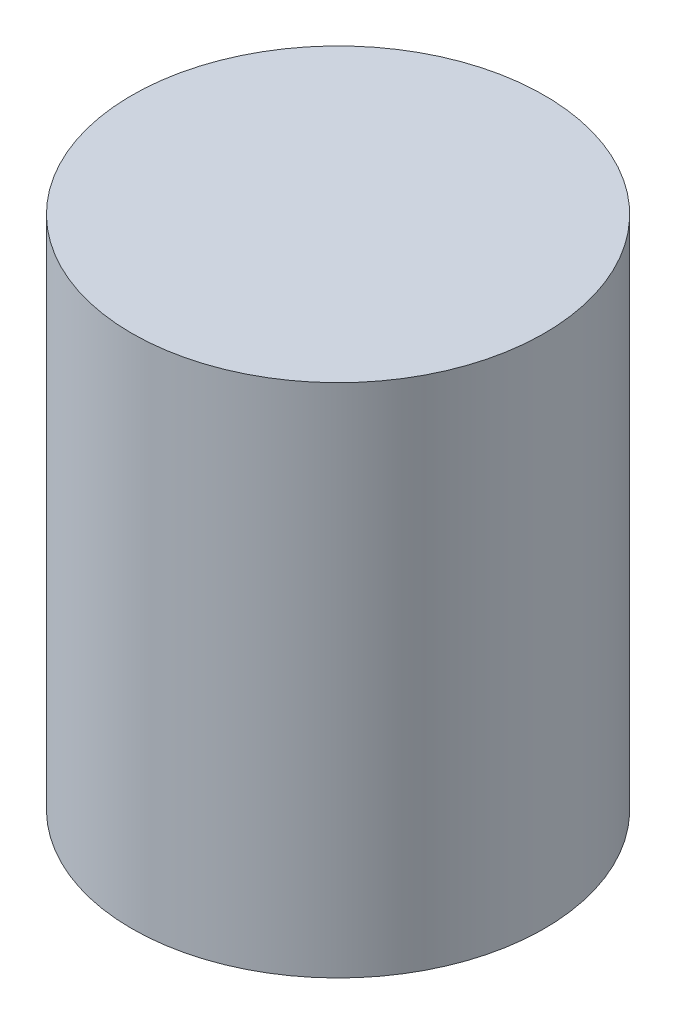
from build123d import *

# Parameters (mm, degrees)
DROGUE_CHUTE_PROFILE_R  = 50.8
DROGUE_CHUTE_BODY_DEPTH = 127


with BuildPart() as part:
    # Drogue Chute Profile → Drogue Chute Body (new body)
    with BuildSketch(Plane(origin=(0, 0, 0), x_dir=(1, 0, 0), z_dir=(0, 1, 0))):
        with Locations(Location((0, 0, 0), (0, 0, 270))):
            Circle(DROGUE_CHUTE_PROFILE_R)
    extrude(amount=DROGUE_CHUTE_BODY_DEPTH)


solid = part.part
